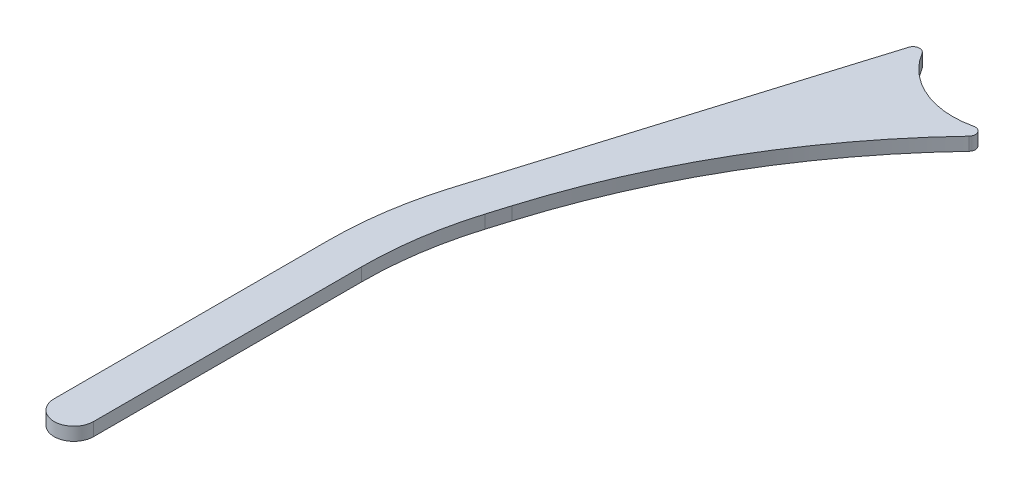
from build123d import *

# Parameters (mm, degrees)
BOSS_EXTRUDE1_DEPTH = 6.35


with BuildPart() as part:
    # Sketch1 → Boss-Extrude1 (new body)
    with BuildSketch(Plane(origin=(0, 0, 0), x_dir=(1, 0, 0), z_dir=(0, 1, 0))):
        with BuildLine():
            Line((-99.020583087, -242.427582229), (-99.020583087, -374.65))
            ThreePointArc((-99.020583087, -374.65), (-89.495583087, -384.175), (-79.970583087, -374.65))
            Line((-79.970583087, -374.65), (-79.970583087, -245.266880288))
            ThreePointArc((-79.970583087, -245.266880288), (-78.028039526, -219.05629054), (-72.242855135, -193.418425341))
            Line((-72.242855135, -193.418425341), (-69.161727013, -183.311770075))
            ThreePointArc((-69.161727013, -183.311770075), (-36.664014716, -108.894116093), (12.050429612, -43.924958467))
            ThreePointArc((12.050429612, -43.924958467), (12.501856954, -40.160483954), (9.02530478, -38.647658789))
            ThreePointArc((9.02530478, -38.647658789), (-15.385960803, -36.583737732), (-33.934614128, -20.580078236))
            ThreePointArc((-33.934614128, -20.580078236), (-37.044039814, -19.076108136), (-39.686388117, -21.300619228))
            Line((-39.686388117, -21.300619228), (-91.292855135, -190.579127282))
            ThreePointArc((-91.292855135, -190.579127282), (-97.078039526, -216.216992482), (-99.020583087, -242.427582229))
        make_face()
    extrude(amount=BOSS_EXTRUDE1_DEPTH)


solid = part.part
